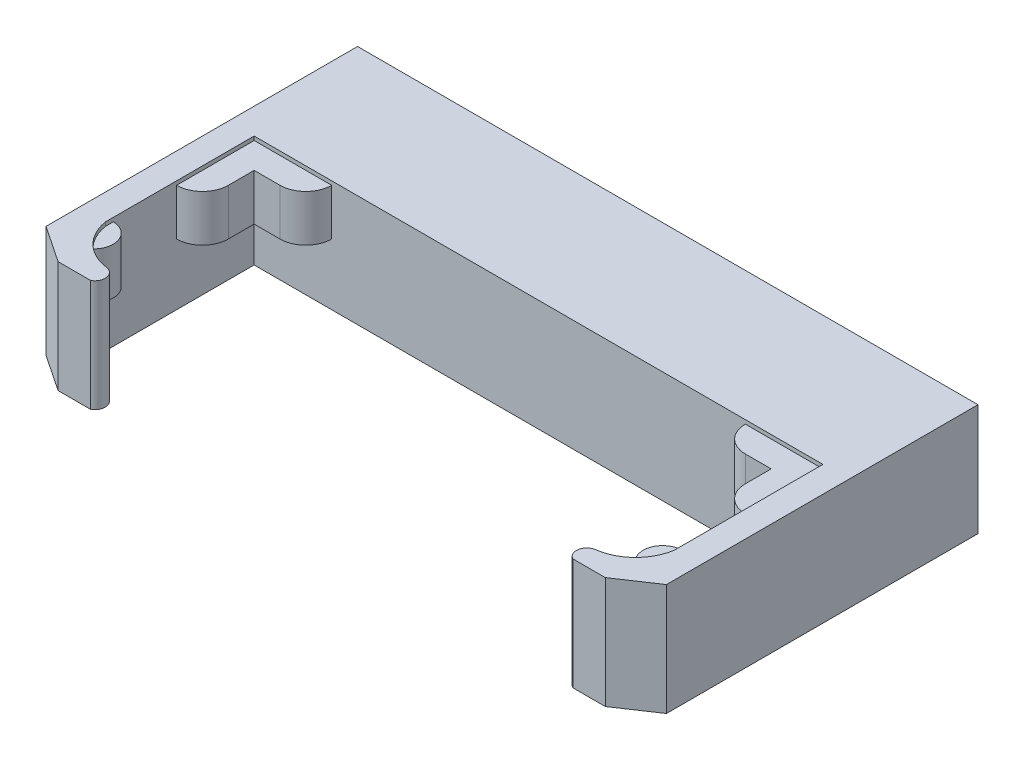
from build123d import *

# Parameters (mm, degrees)
BOSS_EXTRUDE1_START   = -19.2
BOSS_EXTRUDE1_DEPTH   = 43.2
SKETCH4_W             = 194
SKETCH4_H             = 38
CUT_EXTRUDE1_DEPTH    = 41.2
CUT_EXTRUDE2_DEPTH    = 21
SKETCH7_R             = 8
CUT_EXTRUDE3_DEPTH    = 21
BOSS_EXTRUDE3_DEPTH   = 18
BOSS_EXTRUDE3_2_DEPTH = 18


with BuildPart() as part:
    # Sketch1 → Boss-Extrude1 (new body)
    with BuildSketch(Plane(origin=(0, 0, 0), x_dir=(1, 0, 0), z_dir=(0, 1, 0)).offset(BOSS_EXTRUDE1_START)):
        with BuildLine():
            Line((-110, 50), (-110, -7.5))
            ThreePointArc((-110, -7.5), (-104.755451902, -17.601037804), (-94.5, -22.536820999))
            ThreePointArc((-94.5, -22.536820999), (-91.210601206, -25.822153148), (-93.25, -30))
            Line((-93.25, -30), (-105.831019797, -30))
            Line((-105.831019797, -30), (-120, -20.509486036))
            Line((-120, -20.509486036), (-120, 50))
            Line((-120, 50), (-120, 100))
            Line((-120, 100), (120, 100))
            Line((120, 100), (120, 50))
            Line((120, 50), (120, -8.2))
            Line((120, -8.2), (105.831019797, -30))
            Line((105.831019797, -30), (93.25, -30))
            ThreePointArc((93.25, -30), (91.210601206, -25.822153148), (94.5, -22.536820999))
            ThreePointArc((94.5, -22.536820999), (104.755451902, -17.601037804), (110, -7.5))
            Line((110, -7.5), (110, 50))
            Line((110, 50), (-110, 50))
        make_face()
    boss_extrude1 = extrude(amount=BOSS_EXTRUDE1_DEPTH)

    # Sketch4 → Cut-Extrude1 (cut)
    with BuildSketch(Plane(origin=(0, 24, 0), x_dir=(1, 0, 0), z_dir=(0, 1, 0))):
        with Locations((0, 75)):
            Rectangle(SKETCH4_W, SKETCH4_H)
    extrude(amount=-CUT_EXTRUDE1_DEPTH, mode=Mode.SUBTRACT)

    # Sketch5 → Cut-Extrude2 (cut)
    with BuildSketch(Plane(origin=(-97, 0, 0), x_dir=(0, 0, -1), z_dir=(1, 0, 0))):
        with BuildLine():
            Line((79.502499306, 11.5), (88.035, 11.5))
            Line((88.035, 11.5), (88.035, -11.5))
            Line((88.035, -11.5), (79.502499306, -11.5))
            ThreePointArc((79.502499306, -11.5), (75, -12.35), (70.497500694, -11.5))
            Line((70.497500694, -11.5), (61.965, -11.5))
            Line((61.965, -11.5), (61.965, 11.5))
            Line((61.965, 11.5), (70.497500694, 11.5))
            ThreePointArc((70.497500694, 11.5), (75, 12.35), (79.502499306, 11.5))
        make_face()
    cut_extrude2 = extrude(amount=-CUT_EXTRUDE2_DEPTH, mode=Mode.SUBTRACT)

    # Sketch7 → Cut-Extrude3 (cut)
    with BuildSketch(Plane(origin=(-118, 0, 0), x_dir=(0, 0, -1), z_dir=(1, 0, 0))):
        with Locations((75, 0)):
            Circle(SKETCH7_R)
    cut_extrude3 = extrude(amount=-CUT_EXTRUDE3_DEPTH, mode=Mode.SUBTRACT)

    # Mirror1: Cut-Extrude2, Cut-Extrude3 across plane
    add(cut_extrude2.mirror(Plane(origin=(0, 0, 0), x_dir=(0, 0, 1), z_dir=(1, 0, 0))), mode=Mode.SUBTRACT)
    add(cut_extrude3.mirror(Plane(origin=(0, 0, 0), x_dir=(0, 0, 1), z_dir=(1, 0, 0))), mode=Mode.SUBTRACT)

    # Mirror4: Boss-Extrude1 across plane
    add(boss_extrude1.mirror(Plane(origin=(0, 0, 0), x_dir=(0, 0, 1), z_dir=(1, 0, 0))))


with BuildPart() as body_2:
    # Sketch8 → Boss-Extrude3 (new body)
    with BuildSketch(Plane(origin=(0, 4.5, 0), x_dir=(1, 0, 0), z_dir=(0, 1, 0))):
        with BuildLine():
            Line((-110, -4.5), (-110, -19.5))
            ThreePointArc((-110, -19.5), (-102.5, -12), (-110, -4.5))
        make_face()
    boss_extrude3 = extrude(amount=BOSS_EXTRUDE3_DEPTH)


with BuildPart() as body_3:
    # Sketch8 → Boss-Extrude3 2 (new body)
    with BuildSketch(Plane(origin=(0, 4.5, 0), x_dir=(1, 0, 0), z_dir=(0, 1, 0))):
        with BuildLine():
            Line((-80, 50), (-90, 50))
            Line((-90, 50), (-110, 50))
            Line((-110, 50), (-110, 30))
            Line((-110, 30), (-110, 20))
            ThreePointArc((-110, 20), (-102.928932188, 22.928932188), (-100, 30))
            Line((-100, 30), (-100, 40))
            Line((-100, 40), (-90, 40))
            ThreePointArc((-90, 40), (-82.928932188, 42.928932188), (-80, 50))
        make_face()
    boss_extrude3_2 = extrude(amount=BOSS_EXTRUDE3_2_DEPTH)


with BuildPart() as part_1:
    add(part.part)

    # Mirror2: Boss-Extrude3, Boss-Extrude3 2 across plane
    add(boss_extrude3.mirror(Plane(origin=(0, 0, 0), x_dir=(0, 0, 1), z_dir=(1, 0, 0))))
    add(boss_extrude3_2.mirror(Plane(origin=(0, 0, 0), x_dir=(0, 0, 1), z_dir=(1, 0, 0))))


solid = Compound([body_2.part, body_3.part, part_1.part])
